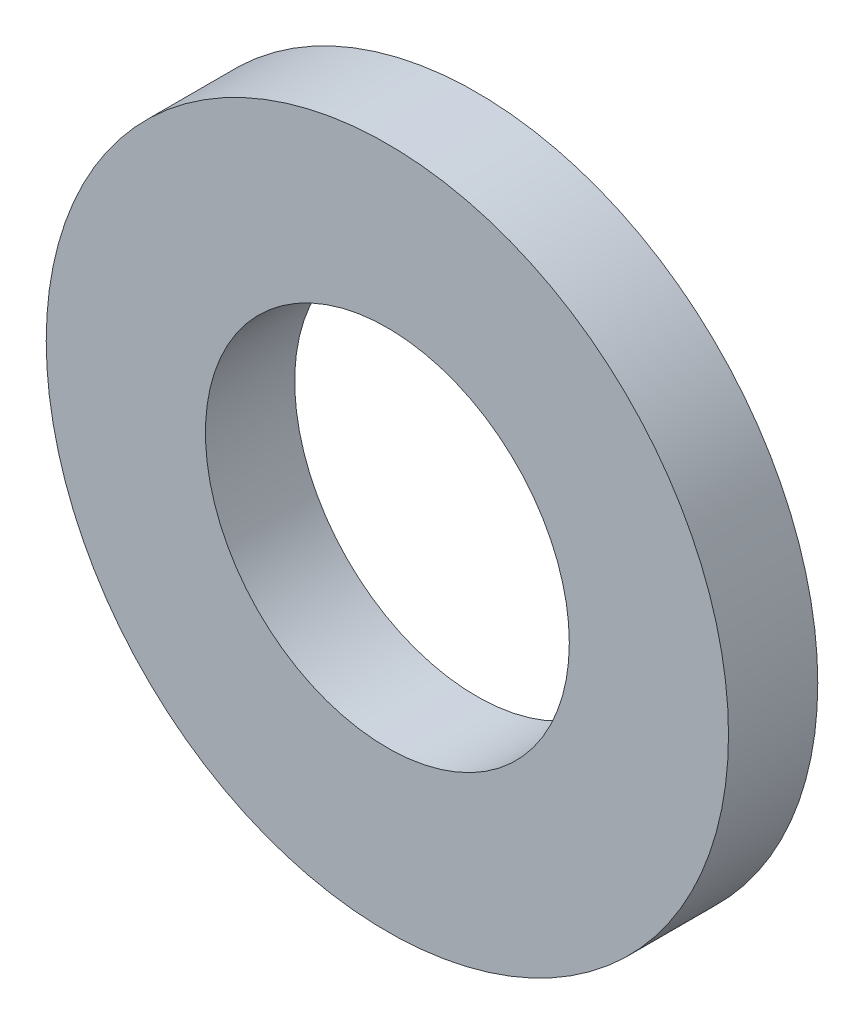
from build123d import *

# Parameters (mm, degrees)
SKETCH3_R           = 6
SKETCH3_R_2         = 3.2
BOSS_EXTRUDE1_DEPTH = 1.57


with BuildPart() as part:
    # Sketch3 → Boss-Extrude1 (new body)
    with BuildSketch(Plane.XY):
        Circle(SKETCH3_R)
        Circle(SKETCH3_R_2, mode=Mode.SUBTRACT)
    extrude(amount=-BOSS_EXTRUDE1_DEPTH)


solid = part.part
